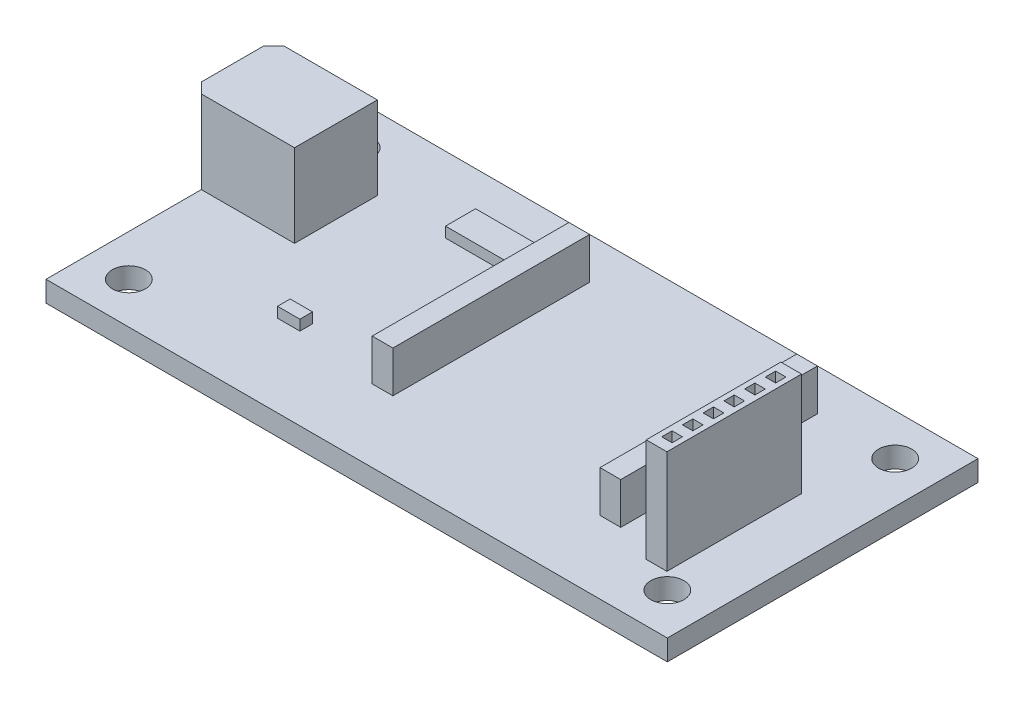
from build123d import *

# Parameters (mm, degrees)
SKETCH1_W           = 60
SKETCH1_H           = 30
SKETCH1_R           = 1.6
BOSS_EXTRUDE1_DEPTH = 2
SKETCH2_W           = 2
SKETCH2_H           = 19
BOSS_EXTRUDE2_DEPTH = 4
SKETCH3_W           = 2
SKETCH3_H           = 13
BOSS_EXTRUDE3_DEPTH = 10
SKETCH4_W           = 5.906565556
SKETCH4_H           = 2.906405273
SKETCH4_W_2         = 2.156365203
SKETCH4_H_2         = 1.218815115
BOSS_EXTRUDE4_DEPTH = 1
BOSS_EXTRUDE5_DEPTH = 8
SKETCH7_W           = 3
SKETCH7_H           = 3
CUT_EXTRUDE1_DEPTH  = 9
SKETCH9_W           = 1
SKETCH9_H           = 1
CUT_EXTRUDE2_DEPTH  = 9


with BuildPart() as part:
    # Sketch1 → Boss-Extrude1 (new body)
    with BuildSketch(Plane(origin=(0, 0, 0), x_dir=(1, 0, 0), z_dir=(0, 1, 0))):
        with Locations((30, 15)):
            Rectangle(SKETCH1_W, SKETCH1_H)
        with Locations(Location((4, 4, 0), (0, 0, 270))):
            Circle(SKETCH1_R, mode=Mode.SUBTRACT)
        with Locations(Location((4, 26, 0), (0, 0, 90))):
            Circle(SKETCH1_R, mode=Mode.SUBTRACT)
        with Locations(Location((56, 26, 0), (0, 0, 270))):
            Circle(SKETCH1_R, mode=Mode.SUBTRACT)
        with Locations(Location((56, 4, 0), (0, 0, 90))):
            Circle(SKETCH1_R, mode=Mode.SUBTRACT)
    extrude(amount=BOSS_EXTRUDE1_DEPTH)

    # Sketch2 → Boss-Extrude2 (add)
    with BuildSketch(Plane(origin=(0, 2, 0), x_dir=(1, 0, 0), z_dir=(0, 1, 0))):
        with Locations((25.5, 16.5)):
            Rectangle(SKETCH2_W, SKETCH2_H)
        with Locations((47.5, 16.5)):
            Rectangle(SKETCH2_W, SKETCH2_H)
    extrude(amount=BOSS_EXTRUDE2_DEPTH)

    # Sketch3 → Boss-Extrude3 (add)
    with BuildSketch(Plane(origin=(0, 2, 0), x_dir=(1, 0, 0), z_dir=(0, 1, 0))):
        with Locations((53.405190381, 12.053258952)):
            Rectangle(SKETCH3_W, SKETCH3_H)
    extrude(amount=BOSS_EXTRUDE3_DEPTH)

    # Sketch4 → Boss-Extrude4 (add)
    with BuildSketch(Plane(origin=(0, 2, 0), x_dir=(1, 0, 0), z_dir=(0, 1, 0))):
        with Locations((18.796276446, 24.187990865)):
            Rectangle(SKETCH4_W, SKETCH4_H)
        with Locations((15.514851138, 8.530904392)):
            Rectangle(SKETCH4_W_2, SKETCH4_H_2)
    extrude(amount=BOSS_EXTRUDE4_DEPTH)

    # Sketch6 → Boss-Extrude5 (add)
    with BuildSketch(Plane(origin=(0, 2, 0), x_dir=(1, 0, 0), z_dir=(0, 1, 0))):
        Polygon((9, 23), (9, 15), (0, 15), (-1, 16), (-1, 22), (0, 23), align=None)
    extrude(amount=BOSS_EXTRUDE5_DEPTH)

    # Sketch7 → Cut-Extrude1 (cut)
    with BuildSketch(Plane.ZY.offset(1)):
        with Locations((-19, 7.75)):
            Rectangle(SKETCH7_W, SKETCH7_H)
        with Locations((-19, 4.25)):
            Rectangle(SKETCH7_W, SKETCH7_H)
    extrude(amount=-CUT_EXTRUDE1_DEPTH, mode=Mode.SUBTRACT)

    # Sketch9 → Cut-Extrude2 (cut)
    with BuildSketch(Plane(origin=(0, 12, 0), x_dir=(1, 0, 0), z_dir=(0, 1, 0))):
        with Locations((53.405190381, 13.053258952)):
            Rectangle(SKETCH9_W, SKETCH9_H)
        with Locations((53.405190381, 17.053258952)):
            Rectangle(SKETCH9_W, SKETCH9_H)
        with Locations((53.405190381, 15.053258952)):
            Rectangle(SKETCH9_W, SKETCH9_H)
        with Locations((53.405190381, 11.053258952)):
            Rectangle(SKETCH9_W, SKETCH9_H)
        with Locations((53.405190381, 9.053258952)):
            Rectangle(SKETCH9_W, SKETCH9_H)
        with Locations((53.405190381, 7.053258952)):
            Rectangle(SKETCH9_W, SKETCH9_H)
    extrude(amount=-CUT_EXTRUDE2_DEPTH, mode=Mode.SUBTRACT)


solid = part.part
